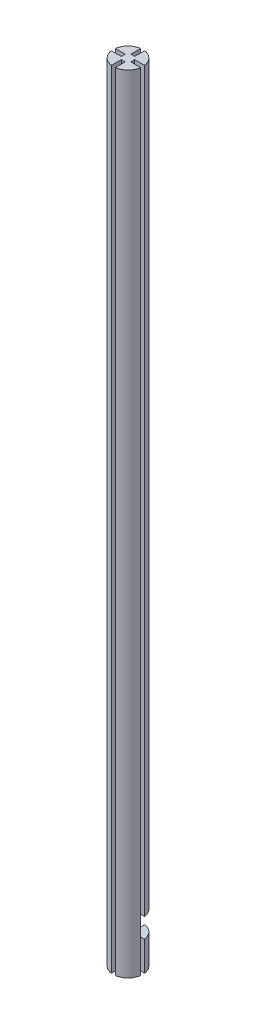
from build123d import *

# Parameters (mm, degrees)
BOSS_EXTRUDE2_DEPTH = 4000
CUT_EXTRUDE1_START  = 200
SKETCH2_W           = 74.330343737
SKETCH2_H           = 74.330343737
CUT_EXTRUDE1_DEPTH  = 50


with BuildPart() as part:
    # Sketch1 → Boss-Extrude2 (new body)
    with BuildSketch(Plane(origin=(0, 0, 0), x_dir=(1, 0, 0), z_dir=(0, 1, 0))):
        with BuildLine():
            Line((-10, 74.330343737), (-10, 24.330343737))
            Line((-10, 24.330343737), (10, 24.330343737))
            Line((10, 24.330343737), (10, 74.330343737))
            ThreePointArc((10, 74.330343737), (53.033008589, 53.033008589), (74.330343737, 10))
            Line((74.330343737, 10), (24.330343737, 10))
            Line((24.330343737, 10), (24.330343737, -10))
            Line((24.330343737, -10), (74.330343737, -10))
            ThreePointArc((74.330343737, -10), (53.033008589, -53.033008589), (10, -74.330343737))
            Line((10, -74.330343737), (10, -24.330343737))
            Line((10, -24.330343737), (-10, -24.330343737))
            Line((-10, -24.330343737), (-10, -74.330343737))
            ThreePointArc((-10, -74.330343737), (-53.033008589, -53.033008589), (-74.330343737, -10))
            Line((-74.330343737, -10), (-24.330343737, -10))
            Line((-24.330343737, -10), (-24.330343737, 10))
            Line((-24.330343737, 10), (-74.330343737, 10))
            ThreePointArc((-74.330343737, 10), (-53.033008589, 53.033008589), (-10, 74.330343737))
        make_face()
    extrude(amount=BOSS_EXTRUDE2_DEPTH)

    # Sketch2 → Cut-Extrude1 (cut, symmetric)
    with BuildSketch(Plane(origin=(0, 0, 0), x_dir=(1, 0, 0), z_dir=(0, 1, 0)).offset(CUT_EXTRUDE1_START)):
        with Locations((37.165171869, 37.165171869)):
            Rectangle(SKETCH2_W, SKETCH2_H)
    extrude(amount=CUT_EXTRUDE1_DEPTH, both=True, mode=Mode.SUBTRACT)


solid = part.part
